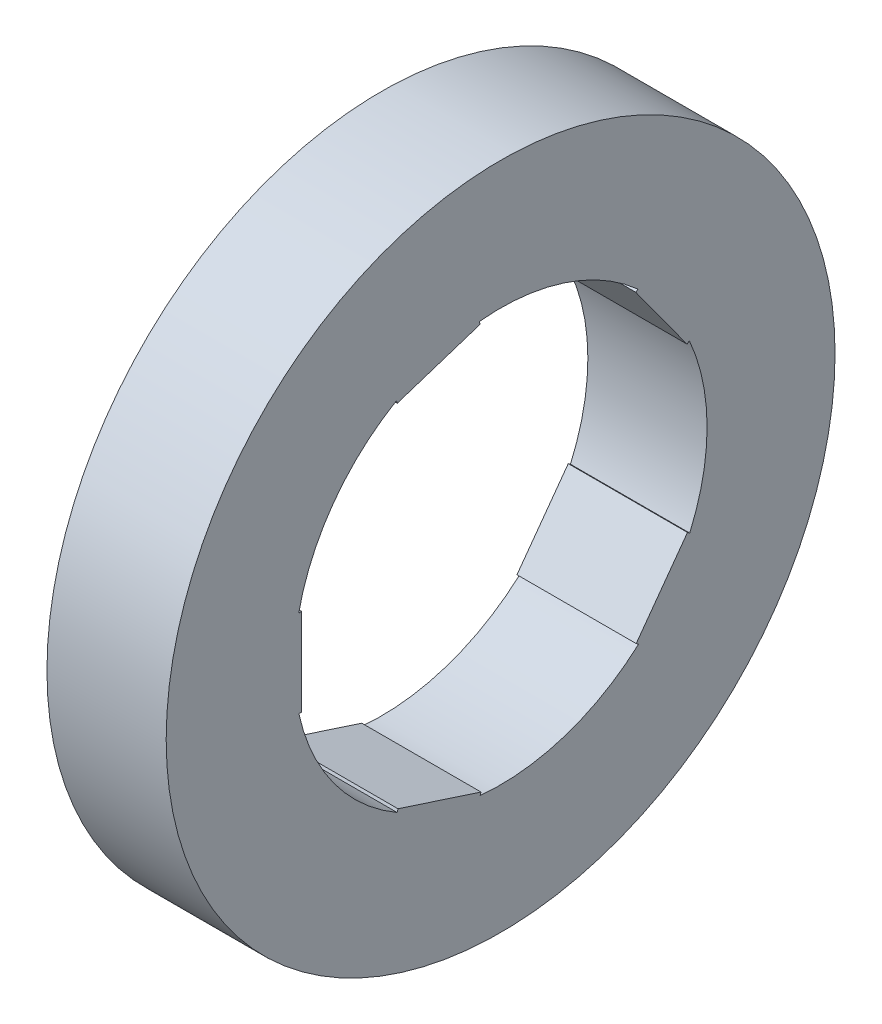
from build123d import *

# Parameters (mm, degrees)
SKIZZE1_R                        = 11.5
AUFSATZ_LINEAR_AUSTRAGEN1_DEPTH  = 77
SCHNITT_LINEAR_AUSTRAGEN1_DEPTH  = 4.1
SKIZZE3_R                        = 2.1
SCHNITT_LINEAR_AUSTRAGEN2_DEPTH  = 3
SKIZZE4_R                        = 9.6
SCHNITT_LINEAR_AUSTRAGEN3_DEPTH  = 12.75
SCHNITT_LINEAR_START             = -6
SKIZZE7_W                        = 1.5
SKIZZE7_H                        = 15
SCHNITT_LINEAR_AUSTRAGEN4_DEPTH  = 63
SKIZZE8_W                        = 63
SKIZZE8_H                        = 4
AUFSATZ_LINEAR_AUSTRAGEN2_DEPTH  = 1.5
SCHNITT_LINEAR_AUSTRAGEN6_DEPTH  = 13.5
SKIZZE12_R                       = 3
SCHNITT_LINEAR_AUSTRAGEN7_DEPTH  = 2
KREISMUSTER3_COUNT               = 3
SKIZZE13_R                       = 8.5
SCHNITT_LINEAR_AUSTRAGEN8_DEPTH  = 40
SKIZZE15_R                       = 14.336938481
SCHNITT_LINEAR_AUSTRAGEN10_DEPTH = 72.9


with BuildPart() as part:
    # Skizze1 → Aufsatz-Linear austragen1 (new body)
    with BuildSketch(Plane(origin=(0, 0, 0), x_dir=(0, 0, -1), z_dir=(1, 0, 0))):
        Circle(SKIZZE1_R)
    extrude(amount=AUFSATZ_LINEAR_AUSTRAGEN1_DEPTH)

    # Skizze2 → Schnitt-Linear austragen1 (cut)
    with BuildSketch(Plane(origin=(77, 0, 0), x_dir=(0, 0, -1), z_dir=(1, 0, 0))):
        with BuildLine():
            Line((-6.942668977, 1.486387391), (-6.842668977, 1.486387391))
            Line((-6.842668977, 1.486387391), (-6.842668977, -1.513612609))
            Line((-6.842668977, -1.513612609), (-6.936784332, -1.513612609))
            ThreePointArc((-6.936784332, -1.513612609), (-5.735823545, -4.184534414), (-3.559041115, -6.143551607))
            Line((-3.559041115, -6.143551607), (-3.528139415, -6.048445955))
            Line((-3.528139415, -6.048445955), (-0.674969866, -6.975496938))
            Line((-0.674969866, -6.975496938), (-0.70405311, -7.06500596))
            ThreePointArc((-0.70405311, -7.06500596), (2.207261771, -6.748184606), (4.743060601, -5.283311096))
            Line((4.743060601, -5.283311096), (4.662158901, -5.224532571))
            Line((4.662158901, -5.224532571), (6.425514658, -2.797481588))
            Line((6.425514658, -2.797481588), (6.50165558, -2.852801206))
            ThreePointArc((6.50165558, -2.852801206), (7.099986341, 0.013926966), (6.490413777, 2.878285776))
            Line((6.490413777, 2.878285776), (6.409512077, 2.819507251))
            Line((6.409512077, 2.819507251), (4.64615632, 5.246558234))
            Line((4.64615632, 5.246558234), (4.722297242, 5.301877852))
            ThreePointArc((4.722297242, 5.301877852), (2.180771108, 6.756791944), (-0.731764286, 7.062189535))
            Line((-0.731764286, 7.062189535), (-0.700862586, 6.967083883))
            Line((-0.700862586, 6.967083883), (-3.554032135, 6.0400329))
            Line((-3.554032135, 6.0400329), (-3.583115379, 6.129541922))
            ThreePointArc((-3.583115379, 6.129541922), (-5.752195675, 4.162000111), (-6.942668977, 1.486387391))
        make_face()
    extrude(amount=-SCHNITT_LINEAR_AUSTRAGEN1_DEPTH, mode=Mode.SUBTRACT)

    # Skizze3 → Schnitt-Linear austragen2 (cut)
    with BuildSketch(Plane(origin=(72.9, 0, 0), x_dir=(0, 0, -1), z_dir=(1, 0, 0))):
        Circle(SKIZZE3_R)
    extrude(amount=-SCHNITT_LINEAR_AUSTRAGEN2_DEPTH, mode=Mode.SUBTRACT)

    # Skizze4 → Schnitt-Linear austragen3 (cut)
    with BuildSketch(Plane.ZY):
        Circle(SKIZZE4_R)
    extrude(amount=-SCHNITT_LINEAR_AUSTRAGEN3_DEPTH, mode=Mode.SUBTRACT)

    # Skizze7 → Schnitt-Linear austragen4 (cut)
    with BuildSketch(Plane(origin=(77, 0, 0), x_dir=(0, 0, -1), z_dir=(1, 0, 0)).offset(SCHNITT_LINEAR_START)):
        with Locations((-10.75, 0)):
            Rectangle(SKIZZE7_W, SKIZZE7_H)
    schnitt_linear_austragen4 = extrude(amount=-SCHNITT_LINEAR_AUSTRAGEN4_DEPTH, mode=Mode.SUBTRACT)

    # Skizze8 → Aufsatz-Linear austragen2 (add)
    with BuildSketch(Plane.XY.offset(10)):
        with Locations((39.5, 0)):
            Rectangle(SKIZZE8_W, SKIZZE8_H)
    aufsatz_linear_austragen2 = extrude(amount=AUFSATZ_LINEAR_AUSTRAGEN2_DEPTH)

    # Skizze10 → Schnitt-Linear austragen6 (cut)
    with BuildSketch(Plane.ZY.offset(-12.75)):
        Polygon((4.038863706, -2.240739453), (3.959969143, 2.377388845), (-0.078894563, 4.618128298), (-4.038863706, 2.240739453), (-3.959969143, -2.377388845), (0.078894563, -4.618128298), align=None)
    extrude(amount=-SCHNITT_LINEAR_AUSTRAGEN6_DEPTH, mode=Mode.SUBTRACT)

    # Skizze12 → Schnitt-Linear austragen7 (cut)
    with BuildSketch(Plane.ZY.offset(-26.25)):
        Circle(SKIZZE12_R)
    extrude(amount=-SCHNITT_LINEAR_AUSTRAGEN7_DEPTH, mode=Mode.SUBTRACT)

    # Kreismuster3: Schnitt-Linear austragen4, Aufsatz-Linear austragen2 ×3 about axis
    kreismuster3_axis = Axis((0, 0, 0), (1, 0, 0))
    add([schnitt_linear_austragen4.rotate(kreismuster3_axis, i * 360 / KREISMUSTER3_COUNT) for i in range(1, KREISMUSTER3_COUNT)], mode=Mode.SUBTRACT)
    add([aufsatz_linear_austragen2.rotate(kreismuster3_axis, i * 360 / KREISMUSTER3_COUNT) for i in range(1, KREISMUSTER3_COUNT)])

    # Skizze13 → Schnitt-Linear austragen8 (cut)
    with BuildSketch(Plane(origin=(69.9, 0, 0), x_dir=(0, 0, -1), z_dir=(1, 0, 0))):
        Circle(SKIZZE13_R)
    extrude(amount=-SCHNITT_LINEAR_AUSTRAGEN8_DEPTH, mode=Mode.SUBTRACT)

    # Skizze15 → Schnitt-Linear austragen10 (cut)
    with BuildSketch(Plane.ZY):
        Circle(SKIZZE15_R)
    extrude(amount=-SCHNITT_LINEAR_AUSTRAGEN10_DEPTH, mode=Mode.SUBTRACT)


solid = part.part
